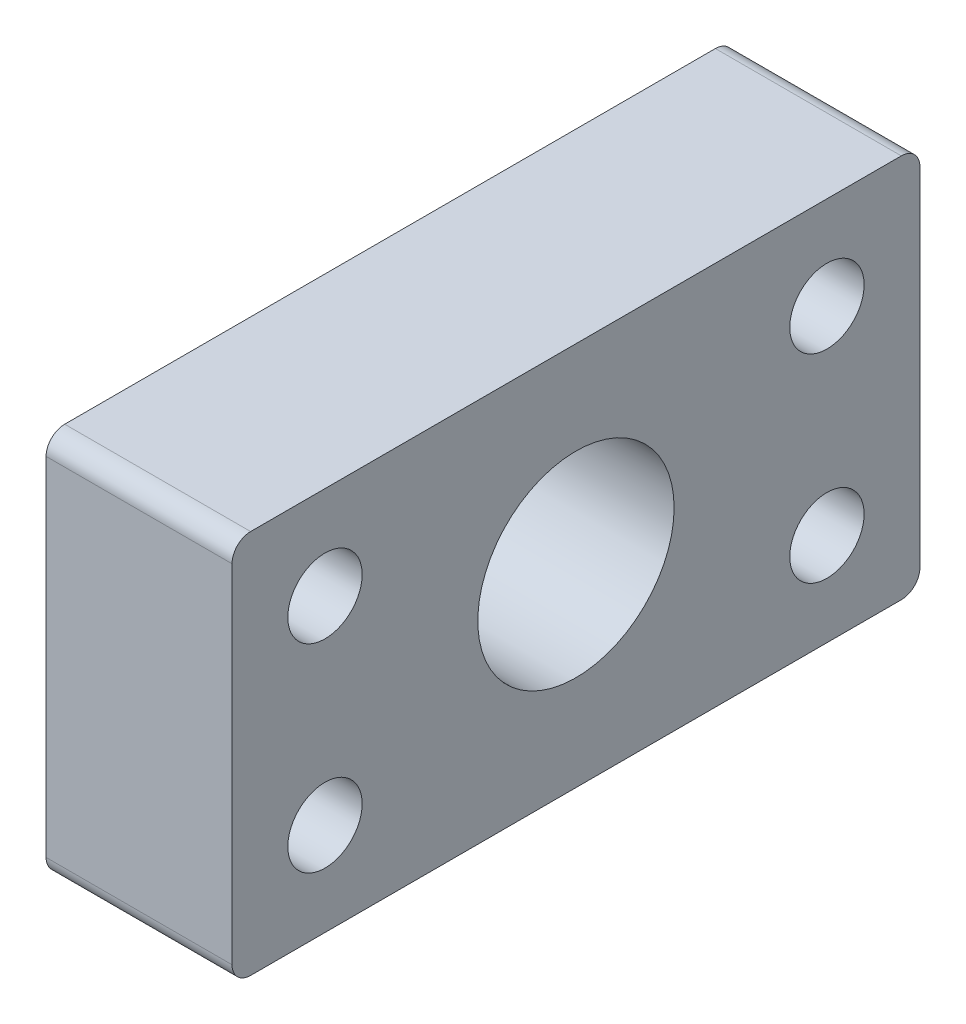
from build123d import *

# Parameters (mm, degrees)
SKETCH_1_R      = 2
SKETCH_1_R_2    = 5.280330007
EXTRUDE_1_DEPTH = 10
FILLET_1_R      = 1


with BuildPart() as part:
    # Эскиз1 → Бобышка-Вытянуть1 (new body)
    with BuildSketch(Plane(origin=(0, 0, 0), x_dir=(0, 0, -1), z_dir=(1, 0, 0))):
        Polygon((-5, 15.68), (-5, 10.68), (-5, 0), (-5, -5), (27, -5), (32, -5), (32, 15.68), align=None)
        Circle(SKETCH_1_R, mode=Mode.SUBTRACT)
        with Locations((27, 0)):
            Circle(SKETCH_1_R, mode=Mode.SUBTRACT)
        with Locations((0, 10.68)):
            Circle(SKETCH_1_R, mode=Mode.SUBTRACT)
        with Locations((13.5, 5.399669993)):
            Circle(SKETCH_1_R_2, mode=Mode.SUBTRACT)
        with Locations((27, 10.68)):
            Circle(SKETCH_1_R, mode=Mode.SUBTRACT)
    extrude(amount=EXTRUDE_1_DEPTH)

    # Скругление1
    fillet_1_edges = [part.edges().sort_by_distance(p)[0] for p in [
        (5, -5, -32),
        (5, -5, 5),
        (5, 15.68, 5),
        (5, 15.68, -32),
    ]]
    fillet(fillet_1_edges, radius=FILLET_1_R)


solid = part.part
